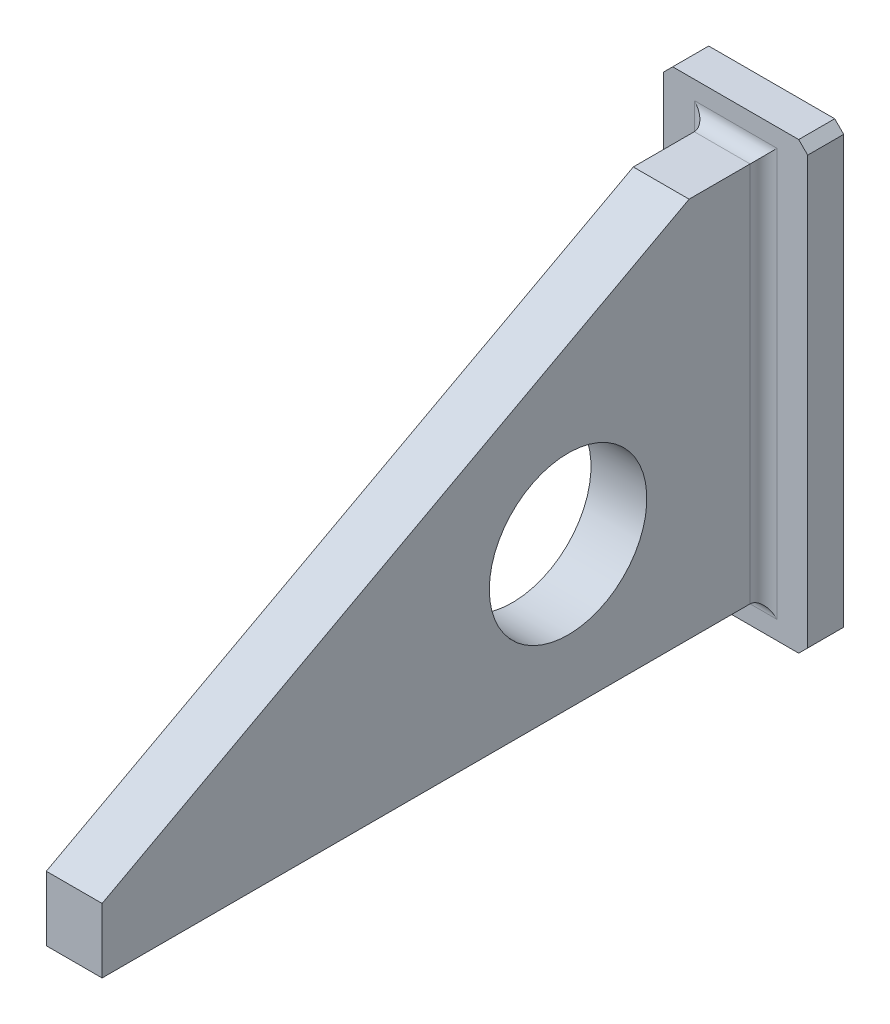
from build123d import *

# Parameters (mm, degrees)
EXTRUDE8_DEPTH  = 15.748
SKETCH8_R       = 22.225
EXTRUDE10_DEPTH = 215.740536803
SKETCH9_W       = 40.631586246
SKETCH9_H       = 125.535865236
EXTRUDE11_DEPTH = 10.16
CHAMFER1_SIZE   = 2.54
FILLET2_R       = 3.81


with BuildPart() as part:
    # Sketch7 → Extrude8 (new body)
    with BuildSketch(Plane(origin=(0, 0, 0), x_dir=(0, 0, -1), z_dir=(1, 0, 0))):
        Polygon((-21.030060514, 104.974134166), (-186.670645251, 15.683506456), (-186.670645251, -2.54), (2.54, -2.54), (2.54, 104.974134166), align=None)
    extrude(amount=EXTRUDE8_DEPTH)

    # Sketch8 → Extrude10 (cut, through all)
    with BuildSketch(Plane(origin=(0, 0, 0), x_dir=(0, 0, -1), z_dir=(1, 0, 0))):
        with Locations(Location((-55.180628977, 37.768492455, 0), (0, 0, 180))):
            Circle(SKETCH8_R)
    extrude(amount=EXTRUDE10_DEPTH, mode=Mode.SUBTRACT)

    # Sketch9 → Extrude11 (add)
    with BuildSketch(Plane.XY):
        with Locations((7.874, 51.217067083)):
            Rectangle(SKETCH9_W, SKETCH9_H)
    extrude(amount=-EXTRUDE11_DEPTH)

    # Chamfer1
    chamfer1_edges = [part.edges().sort_by_distance(p)[0] for p in [
        (28.189793123, 113.984999701, -5.08),
        (28.189793123, -11.550865535, -5.08),
        (-12.441793123, -11.550865535, -5.08),
        (-12.441793123, 113.984999701, -5.08),
    ]]
    chamfer(chamfer1_edges, length=CHAMFER1_SIZE)

    # Fillet2
    fillet2_edges = [part.edges().sort_by_distance(p)[0] for p in [
        (7.874, -2.54, 0),
        (15.748, 51.217067083, 0),
        (7.874, 104.974134166, 0),
        (0, 51.217067083, 0),
    ]]
    fillet(fillet2_edges, radius=FILLET2_R)


solid = part.part
